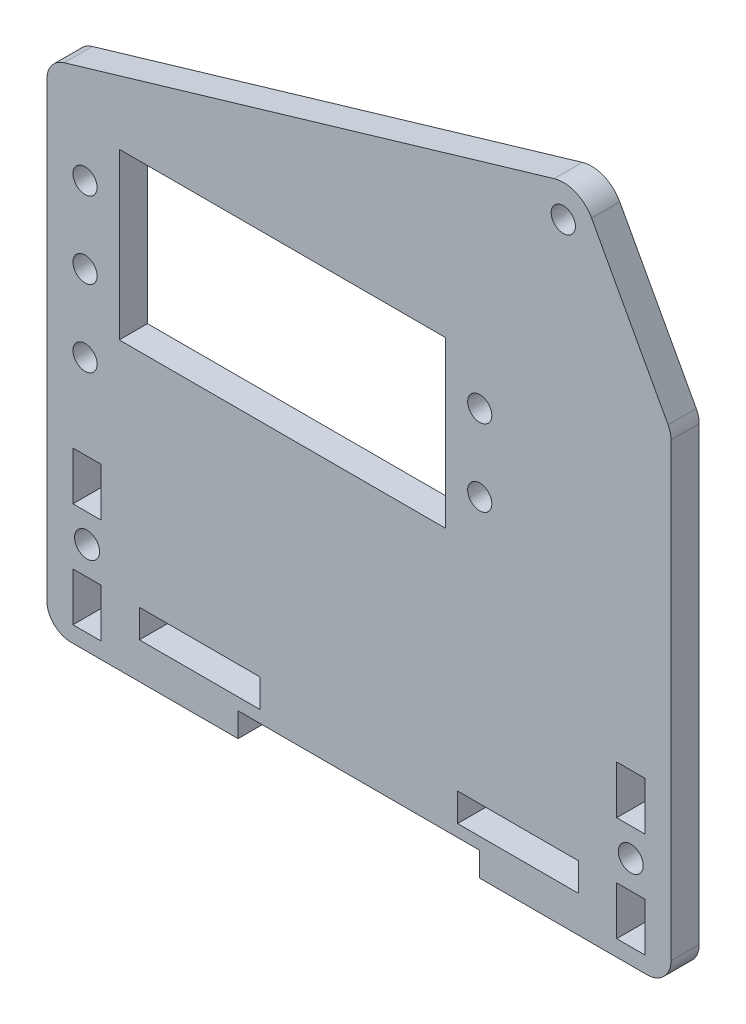
from build123d import *

# Parameters (mm, degrees)
SKETCH1_R           = 1.5
SKETCH1_W           = 40.5
SKETCH1_H           = 20.5
BOSS_EXTRUDE1_DEPTH = 3.5
SKETCH2_R           = 1.55
SKETCH2_W           = 3.5
SKETCH2_H           = 6
CUT_EXTRUDE1_DEPTH  = 63.568462503
SKETCH3_W           = 15
SKETCH3_H           = 3.5
CUT_EXTRUDE2_DEPTH  = 63.568462503
SKETCH4_R           = 1.5
CUT_EXTRUDE3_DEPTH  = 63.568462503
CUT_EXTRUDE5_REACH  = 64.568
SKETCH5_R           = 1.5
SKETCH6_W           = 30
SKETCH6_H           = 3
CUT_EXTRUDE6_DEPTH  = 10


with BuildPart() as part:
    # Sketch1 → Boss-Extrude1 (new body)
    with BuildSketch(Plane.XY):
        with BuildLine():
            Line((-35.75, -31), (35.75, -31))
            ThreePointArc((35.75, -31), (37.871320344, -30.121320344), (38.75, -28))
            Line((38.75, -28), (38.75, 28))
            ThreePointArc((38.75, 28), (38.657529209, 28.739103444), (38.385817399, 29.432643235))
            Line((38.385817399, 29.432643235), (28.88626309, 46.91019098))
            ThreePointArc((28.88626309, 46.91019098), (26.903491848, 48.695137654), (24.239382807, 48.836344739))
            Line((24.239382807, 48.836344739), (-36.599342813, 30.877258554))
            ThreePointArc((-36.599342813, 30.877258554), (-38.152917855, 29.796102943), (-38.75, 28))
            Line((-38.75, 28), (-38.75, -28))
            ThreePointArc((-38.75, -28), (-37.871320344, -30.121320344), (-35.75, -31))
        make_face()
        with Locations((25.371839891, 45)):
            Circle(SKETCH1_R, mode=Mode.SUBTRACT)
        with Locations((-9.5, 14.75)):
            Rectangle(SKETCH1_W, SKETCH1_H, mode=Mode.SUBTRACT)
    extrude(amount=BOSS_EXTRUDE1_DEPTH)

    # Sketch2 → Cut-Extrude1 (cut, through all)
    with BuildSketch(Plane(origin=(0, 0, 0), x_dir=(-1, 0, 0), z_dir=(0, 0, -1))):
        with Locations((-33.75, -19.5)):
            Circle(SKETCH2_R)
        with Locations(Location((33.75, -19.5, 0), (0, 0, 180))):
            Circle(SKETCH2_R)
        with Locations((-33.75, -13)):
            Rectangle(SKETCH2_W, SKETCH2_H)
        with Locations((-33.75, -26)):
            Rectangle(SKETCH2_W, SKETCH2_H)
        with Locations((33.75, -26)):
            Rectangle(SKETCH2_W, SKETCH2_H)
        with Locations((33.75, -13)):
            Rectangle(SKETCH2_W, SKETCH2_H)
    extrude(amount=-CUT_EXTRUDE1_DEPTH, mode=Mode.SUBTRACT)

    # Sketch3 → Cut-Extrude2 (cut, through all)
    with BuildSketch(Plane(origin=(0, 0, 0), x_dir=(-1, 0, 0), z_dir=(0, 0, -1))):
        with Locations((19.75, -24.75)):
            Rectangle(SKETCH3_W, SKETCH3_H)
        with Locations((-19.75, -24.75)):
            Rectangle(SKETCH3_W, SKETCH3_H)
    extrude(amount=-CUT_EXTRUDE2_DEPTH, mode=Mode.SUBTRACT)

    # Sketch4 → Cut-Extrude3 (cut, through all)
    with BuildSketch(Plane(origin=(0, 0, 0), x_dir=(-1, 0, 0), z_dir=(0, 0, -1))):
        with Locations((-15, 19.5)):
            Circle(SKETCH4_R)
        with Locations((-15, 10)):
            Circle(SKETCH4_R)
        with Locations((34, 10)):
            Circle(SKETCH4_R)
        with Locations((34, 19.5)):
            Circle(SKETCH4_R)
    extrude(amount=-CUT_EXTRUDE3_DEPTH, mode=Mode.SUBTRACT)

    # Sketch5 → Cut-Extrude5 (cut, up to next)
    with BuildSketch(Plane(origin=(0, 0, 0), x_dir=(-1, 0, 0), z_dir=(0, 0, -1)), mode=Mode.PRIVATE) as cut_extrude5_sk1:
        with Locations((34, 0.5)):
            Circle(SKETCH5_R)
    cut_extrude5_tool1 = extrude(cut_extrude5_sk1.sketch, amount=-CUT_EXTRUDE5_REACH, mode=Mode.PRIVATE) & part.part
    add(cut_extrude5_tool1.solids().sort_by_distance((-34, 0.5, 0))[0], mode=Mode.SUBTRACT)

    # Sketch6 → Cut-Extrude6 (cut)
    with BuildSketch(Plane.XY.offset(3.5)):
        with Locations((0, -29.5)):
            Rectangle(SKETCH6_W, SKETCH6_H)
    extrude(amount=-CUT_EXTRUDE6_DEPTH, mode=Mode.SUBTRACT)


solid = part.part
